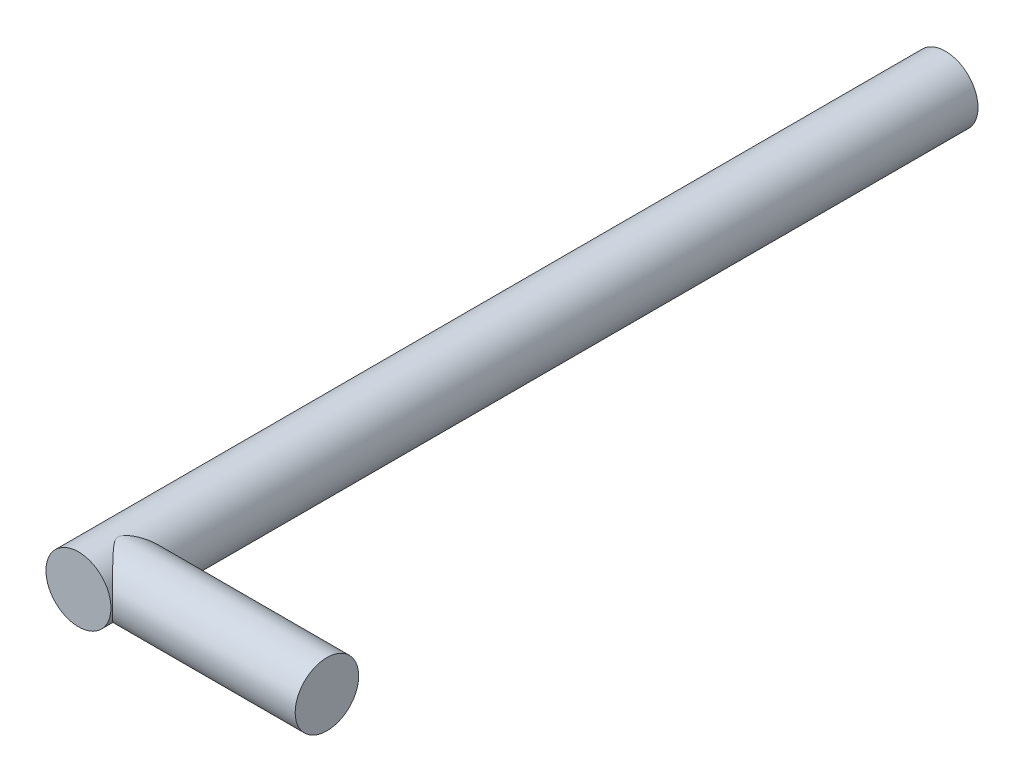
from build123d import *

# Parameters (mm, degrees)
SKETCH3_R           = 1.5
BOSS_EXTRUDE1_DEPTH = 40
SKETCH4_W           = 10
SKETCH4_H           = 1.987336218
EXTRUDE_THIN1_DEPTH = 10
SKETCH7_R           = 1.464965711
BOSS_EXTRUDE4_DEPTH = 10
SKETCH9_W           = 11.25222939
SKETCH9_H           = 3.128852859
CUT_EXTRUDE1_DEPTH  = 57.344455031


with BuildPart() as part:
    # Sketch3 → Boss-Extrude1 (new body)
    with BuildSketch(Plane.XY):
        with Locations((-77.047665821, 20.487229207)):
            Circle(SKETCH3_R)
    extrude(amount=BOSS_EXTRUDE1_DEPTH)

    # Sketch4 → Extrude-Thin1 (add)
    with BuildSketch(Plane.XY.offset(40)):
        with Locations((-72.119350757, 22.979183427)):
            Rectangle(SKETCH4_W, SKETCH4_H)
    extrude(amount=EXTRUDE_THIN1_DEPTH)

    # Sketch7 → Boss-Extrude4 (add)
    with BuildSketch(Plane.ZY.offset(77.119350757)):
        with Locations((38.46487538, 20.493738907)):
            Circle(SKETCH7_R)
    extrude(amount=-BOSS_EXTRUDE4_DEPTH)

    # Sketch9 → Cut-Extrude1 (cut, through all)
    with BuildSketch(Plane.ZY.offset(77.119350757)):
        with Locations((45.626114695, 22.408425107)):
            Rectangle(SKETCH9_W, SKETCH9_H)
    extrude(amount=-CUT_EXTRUDE1_DEPTH, mode=Mode.SUBTRACT)


solid = part.part
